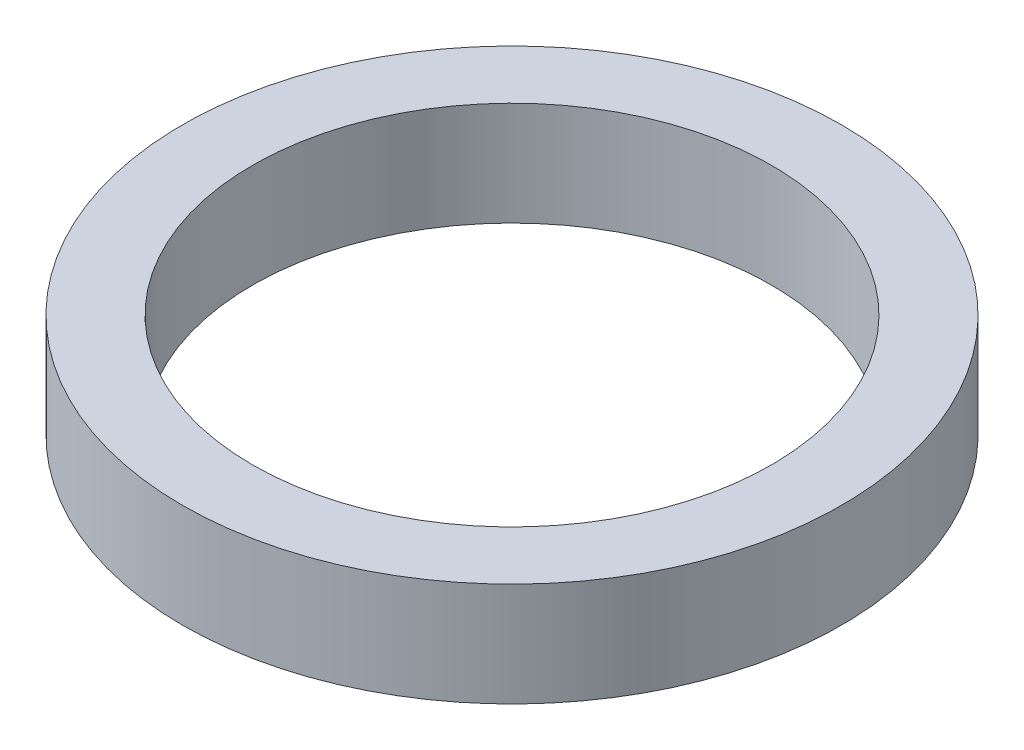
from build123d import *

# Parameters (mm, degrees)
CROQUIS1_R              = 6.35
CROQUIS1_R_2            = 5
SALIENTE_EXTRUIR1_DEPTH = 2


with BuildPart() as part:
    # Croquis1 → Saliente-Extruir1 (new body)
    with BuildSketch(Plane(origin=(0, 0, 0), x_dir=(1, 0, 0), z_dir=(0, 1, 0))):
        with Locations(Location((0, 0, 0), (0, 0, 270))):
            Circle(CROQUIS1_R)
        with Locations(Location((0, 0, 0), (0, 0, 270))):
            Circle(CROQUIS1_R_2, mode=Mode.SUBTRACT)
    extrude(amount=SALIENTE_EXTRUIR1_DEPTH)


solid = part.part
